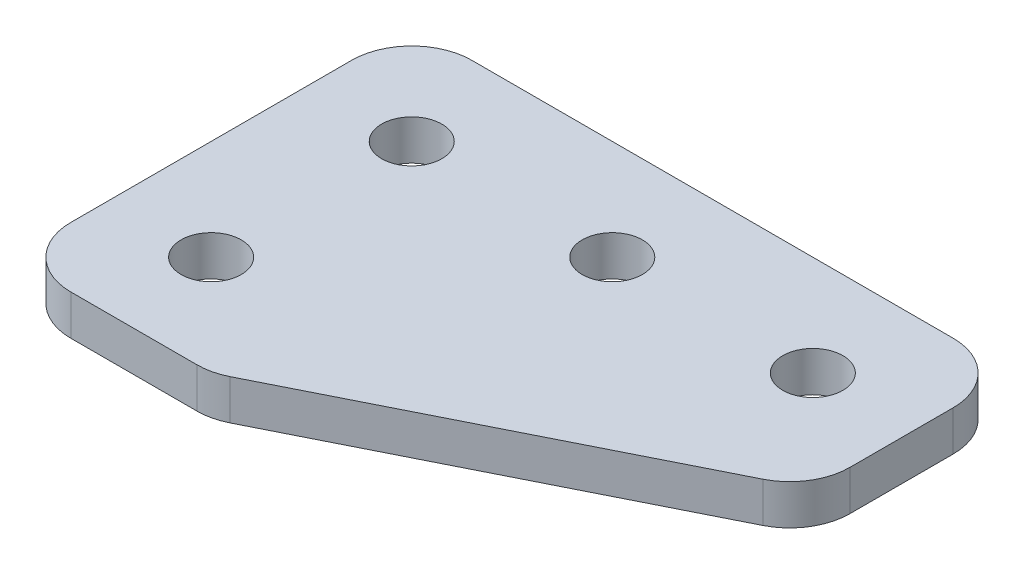
from build123d import *

# Parameters (mm, degrees)
SKETCH_1_R      = 1.5
EXTRUDE_1_DEPTH = 2
FILLET_1_R      = 3


with BuildPart() as part:
    # 草图1 → 凸台-拉伸1 (new body)
    with BuildSketch(Plane(origin=(0, 0, 0), x_dir=(1, 0, 0), z_dir=(0, 1, 0))):
        Polygon((0, 10), (-10, 10), (-10, 0), (-10, -10), (0, -10), (20, 0), (20, 10), align=None)
        with Locations(Location((5, 5, 0), (0, 0, 270))):
            Circle(SKETCH_1_R, mode=Mode.SUBTRACT)
        with Locations(Location((15, 5, 0), (0, 0, 270))):
            Circle(SKETCH_1_R, mode=Mode.SUBTRACT)
        with Locations(Location((-5, 5, 0), (0, 0, 270))):
            Circle(SKETCH_1_R, mode=Mode.SUBTRACT)
        with Locations(Location((-5, -5, 0), (0, 0, 270))):
            Circle(SKETCH_1_R, mode=Mode.SUBTRACT)
    extrude(amount=EXTRUDE_1_DEPTH)

    # 圆角1
    fillet_1_edges = [part.edges().sort_by_distance(p)[0] for p in [
        (20, 1, 0),
        (0, 1, 10),
        (-10, 1, 10),
        (-10, 1, -10),
        (20, 1, -10),
    ]]
    fillet(fillet_1_edges, radius=FILLET_1_R)


solid = part.part
